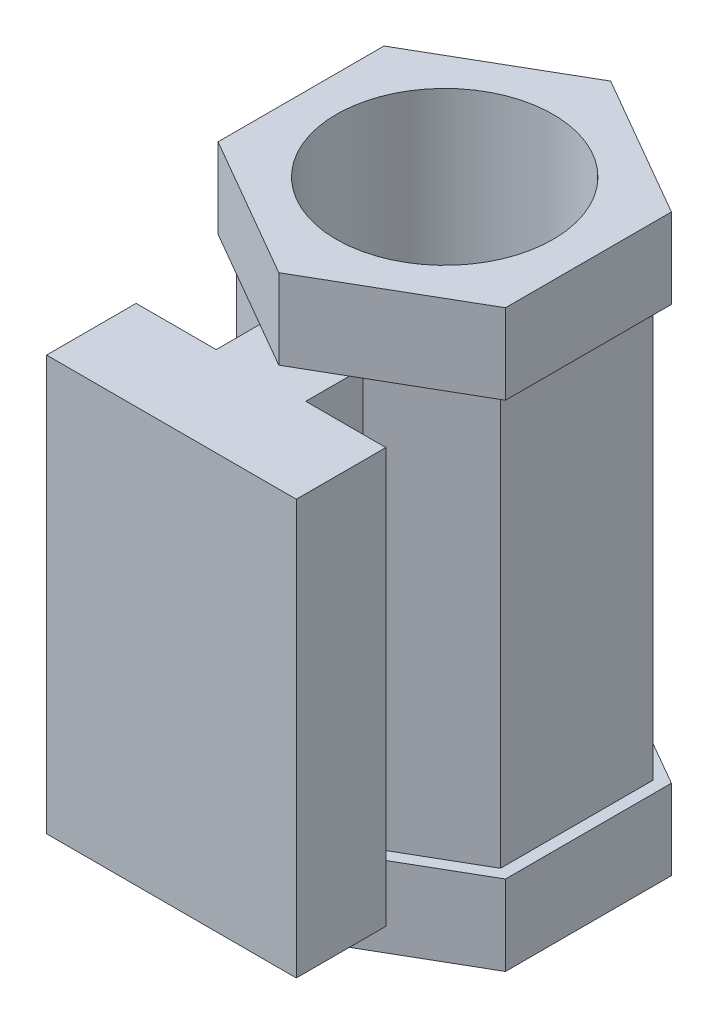
from build123d import *

# Parameters (mm, degrees)
EXTRUDE_1_DEPTH     = 85
EXTRUDE_650_DEPTH   = 440
EXTRUDE_2_DEPTH     = 85
SKETCH_5_R          = 115
CUT_EXTRUDE_1_DEPTH = 693.42779407


with BuildPart() as part:
    # Эскиз2 → Боковой многогранник 1 (new body)
    with BuildSketch(Plane(origin=(0, 0, 0), x_dir=(1, 0, 0), z_dir=(0, 1, 0))):
        Polygon((0, 176.091832103), (-152.5, 88.045916051), (-152.5, -88.045916051), (0, -176.091832103), (152.5, -88.045916051), (152.5, 88.045916051), align=None)
    extrude(amount=EXTRUDE_1_DEPTH)

    # Sketch 292 → Extrude 650 (add)
    with BuildSketch(Plane(origin=(0, 0, 0), x_dir=(1, 0, 0), z_dir=(0, 1, 0))):
        Polygon((0, 161.658075373), (-140, 80.829037687), (-140, -80.829037687), (-47.5, -134.233937587), (-47.5, -195), (-132.5, -195), (-132.5, -290), (132.5, -290), (132.5, -195), (47.5, -195), (47.5, -134.233937587), (140, -80.829037687), (140, 80.829037687), align=None)
    extrude(amount=-EXTRUDE_650_DEPTH)

    # Эскиз4 → Боковой многогранник 2 (add)
    with BuildSketch(Plane.XZ.offset(440)):
        Polygon((0, -176.091832103), (152.5, -88.045916051), (152.5, 88.045916051), (0, 176.091832103), (-152.5, 88.045916051), (-152.5, -88.045916051), align=None)
    extrude(amount=EXTRUDE_2_DEPTH)

    # Эскиз5 → Вырез-Вытянуть1 (cut, through all)
    with BuildSketch(Plane(origin=(0, 85, 0), x_dir=(1, 0, 0), z_dir=(0, 1, 0))):
        with Locations(Location((0, 0, 0), (0, 0, 270))):
            Circle(SKETCH_5_R)
    extrude(amount=-CUT_EXTRUDE_1_DEPTH, mode=Mode.SUBTRACT)


solid = part.part
